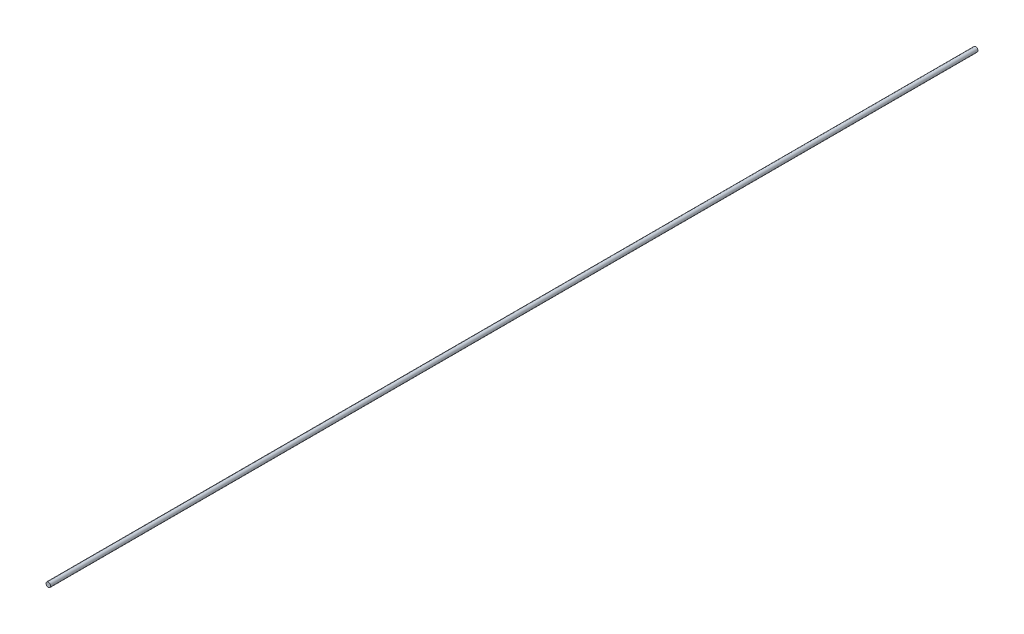
from build123d import *

# Parameters (mm, degrees)
SKETCH1_R           = 0.5
BOSS_EXTRUDE1_DEPTH = 200


with BuildPart() as part:
    # Sketch1 → Boss-Extrude1 (new body)
    with BuildSketch(Plane.XY):
        Circle(SKETCH1_R)
    extrude(amount=BOSS_EXTRUDE1_DEPTH)


solid = part.part
